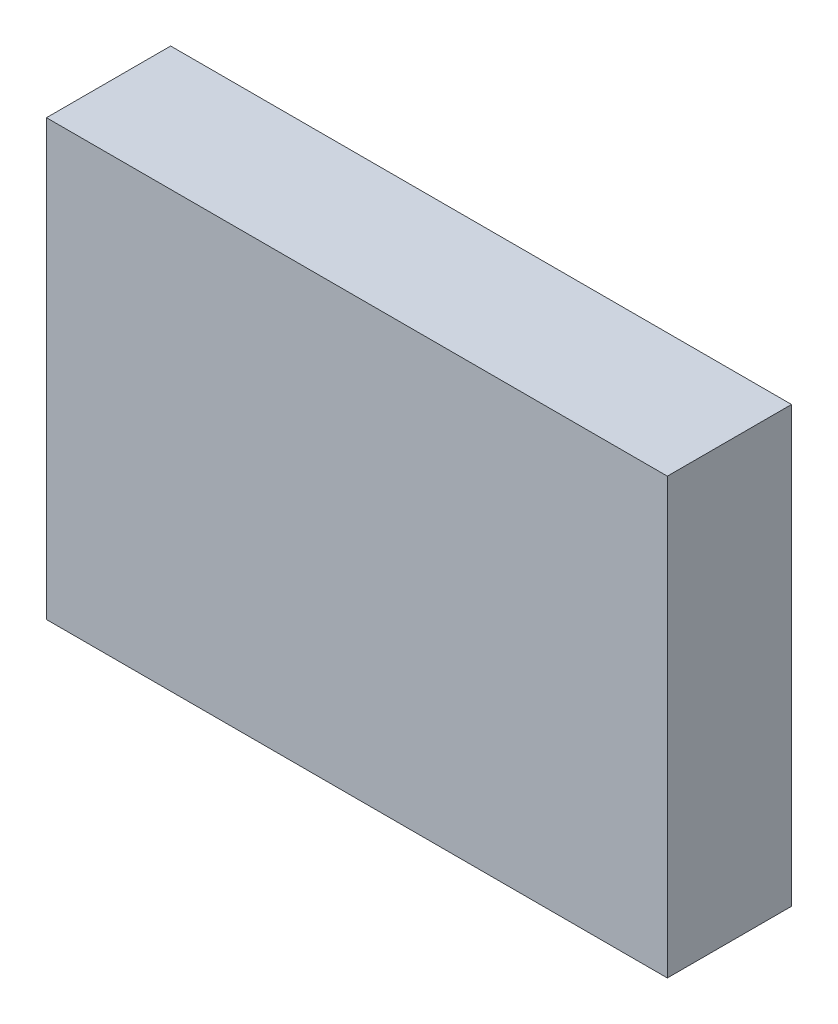
from build123d import *

# Parameters (mm, degrees)
SKETCH_1_W      = 100
SKETCH_1_H      = 70
EXTRUDE_1_DEPTH = 20


with BuildPart() as part:
    # 草图1 → 凸台-拉伸1 (new body)
    with BuildSketch(Plane.XY):
        Rectangle(SKETCH_1_W, SKETCH_1_H)
    extrude(amount=EXTRUDE_1_DEPTH)


solid = part.part
